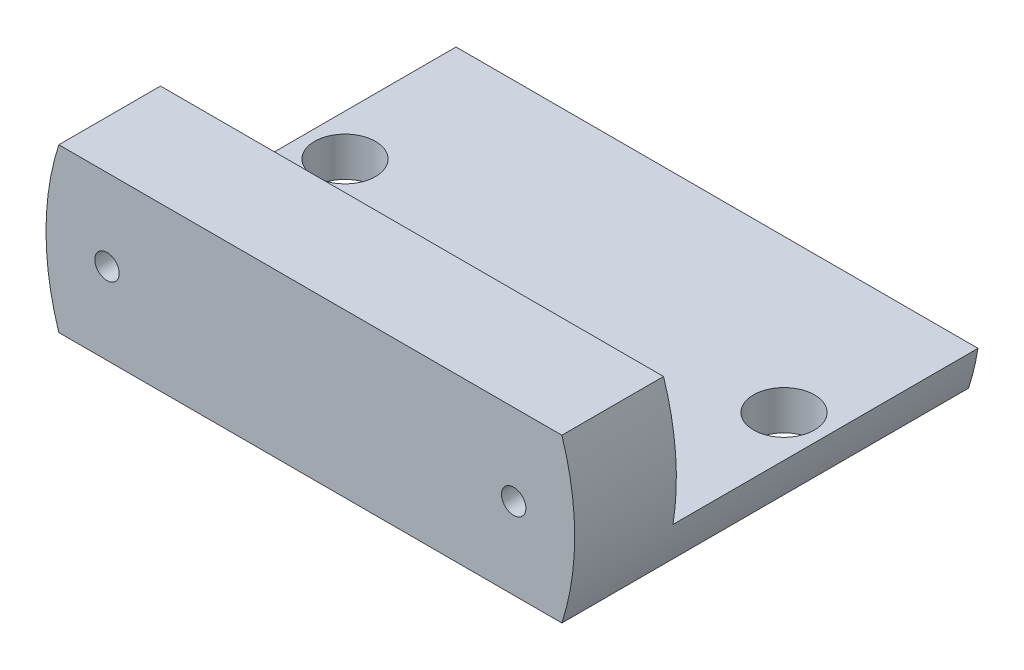
from build123d import *

# Parameters (mm, degrees)
SKETCH2_R           = 0.6
BOSS_EXTRUDE2_DEPTH = 5
BOSS_EXTRUDE4_START = 15
BOSS_EXTRUDE4_DEPTH = 15
SKETCH8_R           = 1.5
CUT_EXTRUDE2_DEPTH  = 21.756494148


with BuildPart() as part:
    # Sketch2 → Boss-Extrude2 (new body)
    with BuildSketch(Plane.XY):
        with BuildLine():
            Line((-11.842719282, 4), (11.842719282, 4))
            Line((11.842719282, 4), (12.369316877, 4))
            ThreePointArc((12.369316877, 4), (13, 0), (12.369316877, -4))
            Line((12.369316877, -4), (11.842719282, -4))
            Line((11.842719282, -4), (-11.842719282, -4))
            Line((-11.842719282, -4), (-12.369316877, -4))
            ThreePointArc((-12.369316877, -4), (-13, 0), (-12.369316877, 4))
            Line((-12.369316877, 4), (-11.842719282, 4))
        make_face()
        with Locations((10, 0)):
            Circle(SKETCH2_R, mode=Mode.SUBTRACT)
        with Locations(Location((-10, 0, 0), (0, 0, 180))):
            Circle(SKETCH2_R, mode=Mode.SUBTRACT)
    extrude(amount=BOSS_EXTRUDE2_DEPTH)

    # Sketch7 → Boss-Extrude4 (add)
    with BuildSketch(Plane(origin=(0, 0, 0), x_dir=(-1, 0, 0), z_dir=(0, 0, -1)).offset(BOSS_EXTRUDE4_START)):
        with BuildLine():
            Line((0, -2.068941366), (-12.32759026, -2.068941366))
            Line((-12.32759026, -2.068941366), (-12.834308771, -2.068941366))
            ThreePointArc((-12.834308771, -2.068941366), (-12.6387473, -3.04336437), (-12.369316877, -4))
            Line((-12.369316877, -4), (-11.842719282, -4))
            Line((-11.842719282, -4), (0, -4))
            Line((0, -4), (11.842719282, -4))
            Line((11.842719282, -4), (12.369316877, -4))
            ThreePointArc((12.369316877, -4), (12.6387473, -3.04336437), (12.834308771, -2.068941366))
            Line((12.834308771, -2.068941366), (12.32759026, -2.068941366))
            Line((12.32759026, -2.068941366), (0, -2.068941366))
        make_face()
    extrude(amount=-BOSS_EXTRUDE4_DEPTH)

    # Sketch8 → Cut-Extrude2 (cut, through all)
    with BuildSketch(Plane(origin=(0, -2.068941366, 0), x_dir=(1, 0, 0), z_dir=(0, 1, 0))):
        with Locations(Location((-10.795, 7.5, 0), (0, 0, 270))):
            Circle(SKETCH8_R)
        with Locations(Location((10.795, 7.5, 0), (0, 0, 90))):
            Circle(SKETCH8_R)
    extrude(amount=-CUT_EXTRUDE2_DEPTH, mode=Mode.SUBTRACT)


solid = part.part
